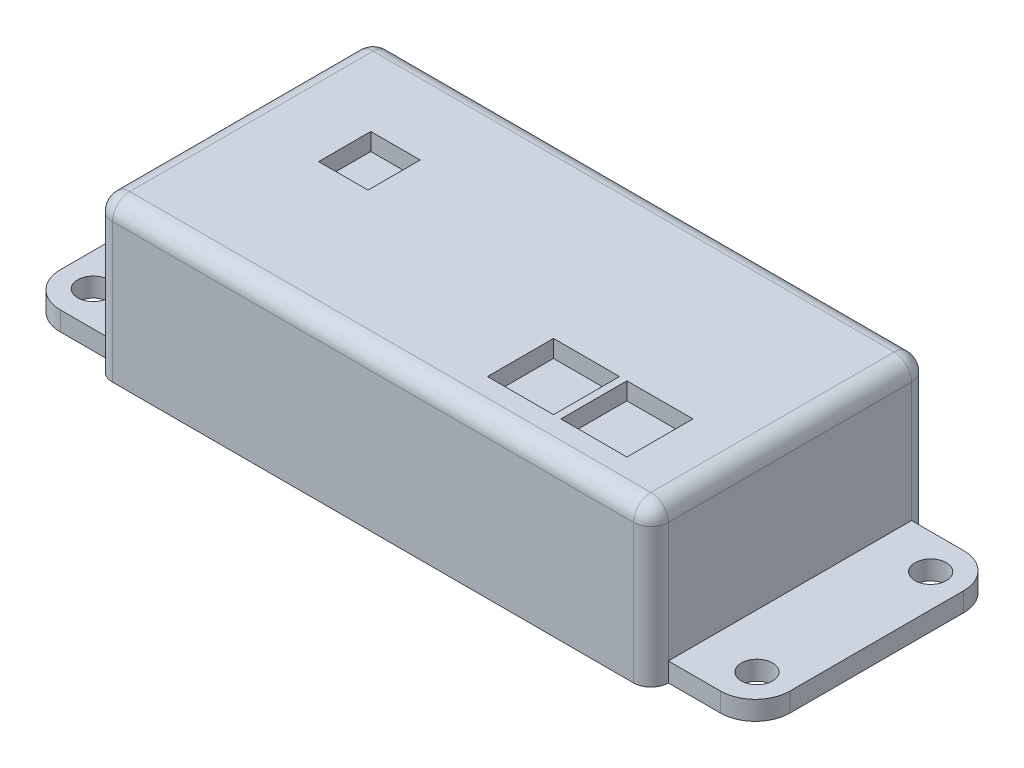
from build123d import *

# Parameters (mm, degrees)
SKETCH1_W            = 81.28
SKETCH1_H            = 40.64
BOSS_EXTRUDE1_DEPTH  = 22.86
FILLET1_R            = 2.54
SKETCH2_W            = 12.7
SKETCH2_H            = 35.56
BOSS_EXTRUDE2_DEPTH  = 2.794
FILLET2_R            = 5.08
SKETCH3_R            = 2.286
CUT_EXTRUDE1_DEPTH   = 61.503738364
FILLET2_OF_MIRROR1_R = 5.08
SKETCH4_W            = 7.230266788
SKETCH4_H            = 7.631948276
SKETCH4_W_2          = 9.652
SKETCH4_H_2          = 9.652
CUT_EXTRUDE2_DEPTH   = 2.54


with BuildPart() as part:
    # Sketch1 → Boss-Extrude1 (new body)
    with BuildSketch(Plane(origin=(0, 0, 0), x_dir=(1, 0, 0), z_dir=(0, 1, 0))):
        Rectangle(SKETCH1_W, SKETCH1_H)
    extrude(amount=BOSS_EXTRUDE1_DEPTH)

    # Fillet1
    fillet1_edges = [part.edges().sort_by_distance(p)[0] for p in [
        (-40.64, 22.86, 0),
        (0, 22.86, 20.32),
        (40.64, 22.86, 0),
        (0, 22.86, -20.32),
        (40.64, 11.43, 20.32),
        (-40.64, 11.43, 20.32),
        (-40.64, 11.43, -20.32),
        (40.64, 11.43, -20.32),
    ]]
    fillet(fillet1_edges, radius=FILLET1_R)

    # Sketch2 → Boss-Extrude2 (add)
    with BuildSketch(Plane.XZ):
        with Locations((46.99, 0)):
            Rectangle(SKETCH2_W, SKETCH2_H)
    boss_extrude2 = extrude(amount=-BOSS_EXTRUDE2_DEPTH)

    # Fillet2
    fillet2_edges = [part.edges().sort_by_distance(p)[0] for p in [
        (53.34, 1.397, 17.78),
        (53.34, 1.397, -17.78),
    ]]
    fillet(fillet2_edges, radius=FILLET2_R)

    # Sketch3 → Cut-Extrude1 (cut, through all)
    with BuildSketch(Plane(origin=(0, 2.794, 0), x_dir=(1, 0, 0), z_dir=(0, 1, 0))):
        with Locations(Location((48.514, 12.7, 0), (0, 0, 270))):
            Circle(SKETCH3_R)
        with Locations(Location((48.514, -12.7, 0), (0, 0, 270))):
            Circle(SKETCH3_R)
    cut_extrude1 = extrude(amount=-CUT_EXTRUDE1_DEPTH, mode=Mode.SUBTRACT)

    # Mirror1: Boss-Extrude2, Cut-Extrude1 across plane
    add(boss_extrude2.mirror(Plane(origin=(0, 0, 0), x_dir=(0, 0, 1), z_dir=(1, 0, 0))))
    add(cut_extrude1.mirror(Plane(origin=(0, 0, 0), x_dir=(0, 0, 1), z_dir=(1, 0, 0))), mode=Mode.SUBTRACT)

    # Fillet2 of Mirror1
    fillet2_of_mirror1_edges = [part.edges().sort_by_distance(p)[0] for p in [
        (-53.34, 1.397, 17.78),
        (-53.34, 1.397, -17.78),
    ]]
    fillet(fillet2_of_mirror1_edges, radius=FILLET2_OF_MIRROR1_R)

    # Sketch4 → Cut-Extrude2 (cut)
    with BuildSketch(Plane(origin=(0, 22.86, 0), x_dir=(1, 0, 0), z_dir=(0, 1, 0))):
        with Locations((-24.473297313, 3.624026455)):
            Rectangle(SKETCH4_W, SKETCH4_H)
        with Locations((16.303343502, -10.232970532)):
            Rectangle(SKETCH4_W_2, SKETCH4_H_2)
        with Locations((27.032885284, -10.232970532)):
            Rectangle(SKETCH4_W_2, SKETCH4_H_2)
    extrude(amount=-CUT_EXTRUDE2_DEPTH, mode=Mode.SUBTRACT)


solid = part.part
